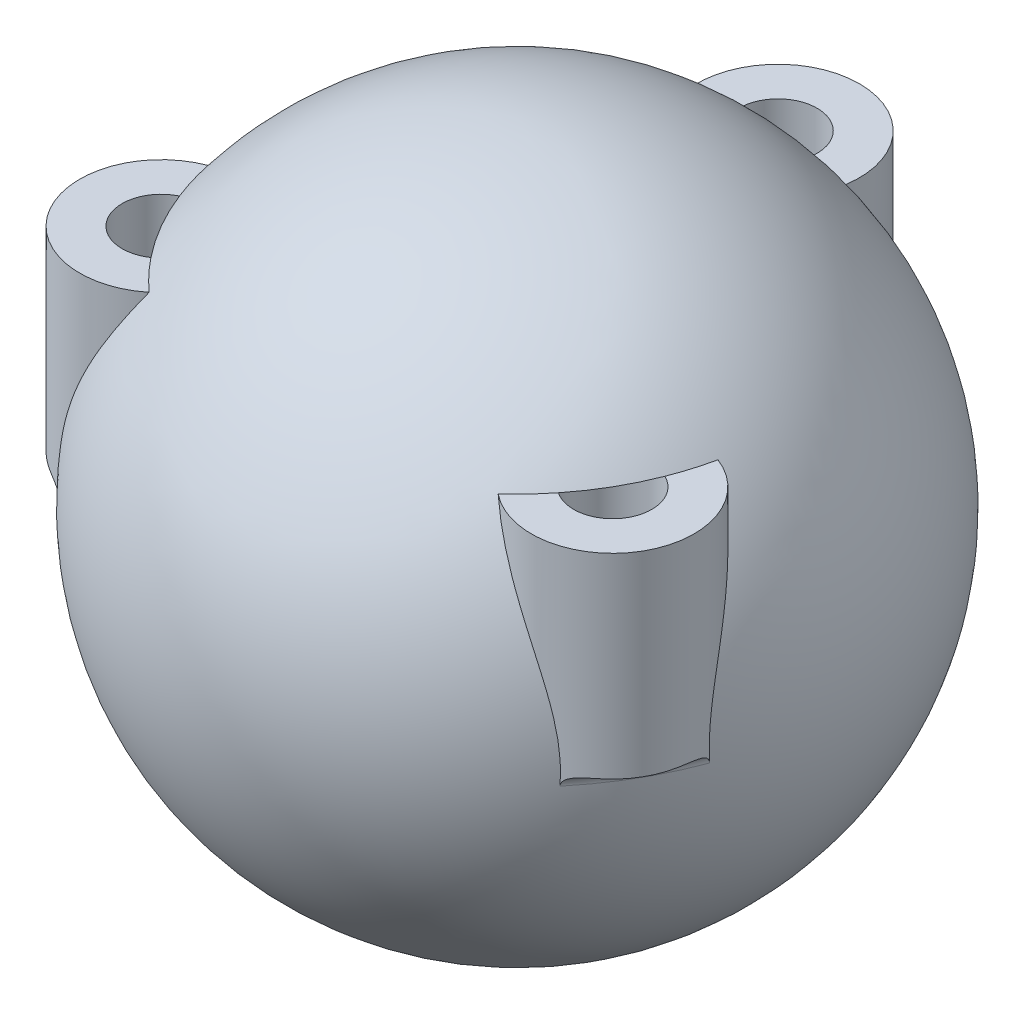
from build123d import *

# Parameters (mm, degrees)
SKETCH2_R           = 12.5
BOSS_EXTRUDE3_DEPTH = 30
SKETCH3_R           = 6
CUT_EXTRUDE1_DEPTH  = 15
FILLET1_R           = 2
SKETCH4_R           = 12
CUT_EXTRUDE2_DEPTH  = 89.069574829


with BuildPart() as part:
    # Sketch1 → Revolve1 (revolve)
    with BuildSketch(Plane.XY):
        with BuildLine():
            ThreePointArc((50, 0), (0, 50), (-50, 0))
            Line((-50, 0), (-38, 0))
            ThreePointArc((-38, 0), (0, 38), (38, 0))
            Line((38, 0), (50, 0))
        make_face()
    revolve(axis=Axis((-50, 0, 0), (1, 0, 0)))

    # Sketch2 → Boss-Extrude3 (add)
    with BuildSketch(Plane(origin=(0, 0, 0), x_dir=(1, 0, 0), z_dir=(0, 1, 0))):
        with Locations((0, 40)):
            Circle(SKETCH2_R)
        with Locations((34.641016151, -20)):
            Circle(SKETCH2_R)
        with Locations((-34.641016151, -20)):
            Circle(SKETCH2_R)
    extrude(amount=BOSS_EXTRUDE3_DEPTH)

    # Sketch3 → Cut-Extrude1 (cut)
    with BuildSketch(Plane(origin=(0, 30, 0), x_dir=(1, 0, 0), z_dir=(0, 1, 0))):
        with Locations(Location((0, 40, 0), (0, 0, 270))):
            Circle(SKETCH3_R)
        with Locations(Location((34.641016151, -20, 0), (0, 0, 270))):
            Circle(SKETCH3_R)
        with Locations(Location((-34.641016151, -20, 0), (0, 0, 270))):
            Circle(SKETCH3_R)
    extrude(amount=-CUT_EXTRUDE1_DEPTH, mode=Mode.SUBTRACT)

    # Fillet1
    fillet1_edges = [part.edges().sort_by_distance(p)[0] for p in [
        (0, 0, -50),
        (43.301270189, 0, 25),
        (-43.301270189, 0, 25),
    ]]
    fillet(fillet1_edges, radius=FILLET1_R)

    # Sketch4 → Cut-Extrude2 (cut, through all)
    with BuildSketch(Plane(origin=(0, 0, 0), x_dir=(1, 0, 0), z_dir=(0, 1, 0))):
        with Locations(Location((0, 0, 0), (0, 0, 270))):
            Circle(SKETCH4_R)
    extrude(amount=-CUT_EXTRUDE2_DEPTH, mode=Mode.SUBTRACT)


solid = part.part
